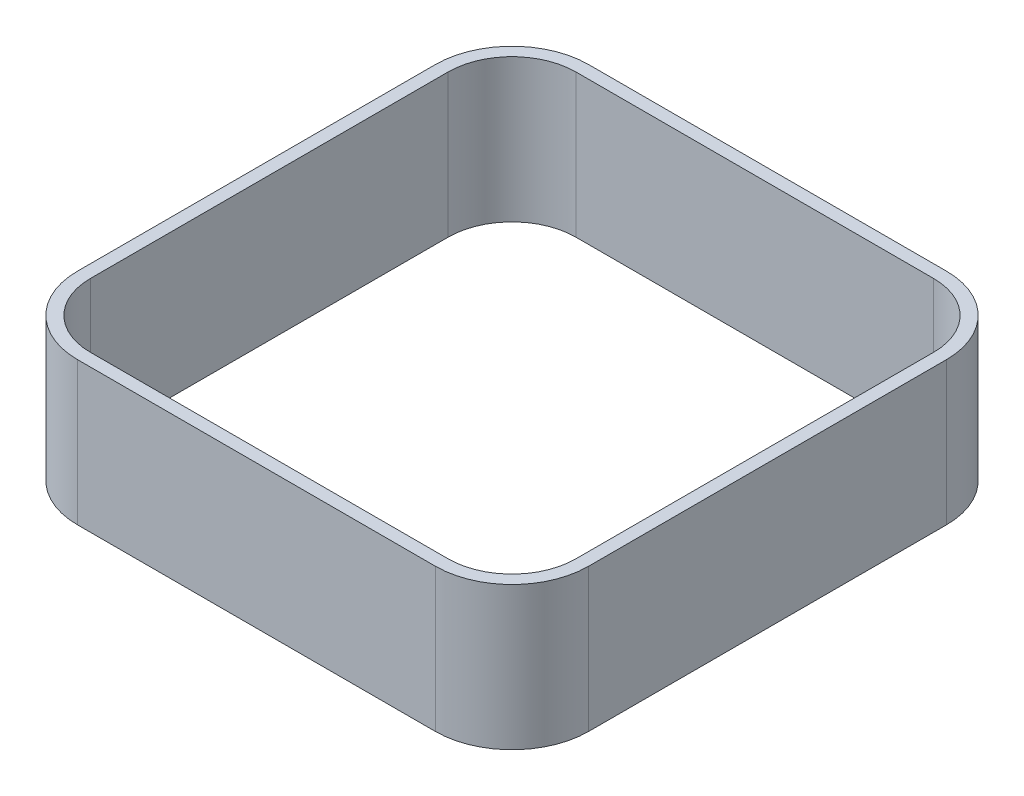
from build123d import *

# Parameters (mm, degrees)
SKETCH1_W           = 508
SKETCH1_H           = 508
BOSS_EXTRUDE1_DEPTH = 142.24
FILLET1_R           = 76.2
CUT_EXTRUDE1_REACH  = 388.347


with BuildPart() as part:
    # Sketch1 → Boss-Extrude1 (new body)
    with BuildSketch(Plane(origin=(0, 0, 0), x_dir=(1, 0, 0), z_dir=(0, 1, 0))):
        Rectangle(SKETCH1_W, SKETCH1_H)
    extrude(amount=BOSS_EXTRUDE1_DEPTH)

    # Fillet1
    fillet1_edges = [part.edges().sort_by_distance(p)[0] for p in [
        (254, 71.12, 254),
        (-254, 71.12, 254),
        (-254, 71.12, -254),
        (254, 71.12, -254),
    ]]
    fillet(fillet1_edges, radius=FILLET1_R)

    # Sketch2 → Cut-Extrude1 (cut, up to next)
    with BuildSketch(Plane(origin=(0, 142.24, 0), x_dir=(1, 0, 0), z_dir=(0, 1, 0)), mode=Mode.PRIVATE) as cut_extrude1_sk1:
        with BuildLine():
            Line((-241.3, 177.8), (-241.3, -177.8))
            ThreePointArc((-241.3, -177.8), (-222.701280605, -222.701280605), (-177.8, -241.3))
            Line((-177.8, -241.3), (177.8, -241.3))
            ThreePointArc((177.8, -241.3), (222.701280605, -222.701280605), (241.3, -177.8))
            Line((241.3, -177.8), (241.3, 177.8))
            ThreePointArc((241.3, 177.8), (222.701280605, 222.701280605), (177.8, 241.3))
            Line((177.8, 241.3), (-177.8, 241.3))
            ThreePointArc((-177.8, 241.3), (-222.701280605, 222.701280605), (-241.3, 177.8))
        make_face()
    cut_extrude1_tool1 = extrude(cut_extrude1_sk1.sketch, amount=-CUT_EXTRUDE1_REACH, mode=Mode.PRIVATE) & part.part
    add(cut_extrude1_tool1.solids().sort_by_distance((0, 142.24, 0))[0], mode=Mode.SUBTRACT)


solid = part.part
